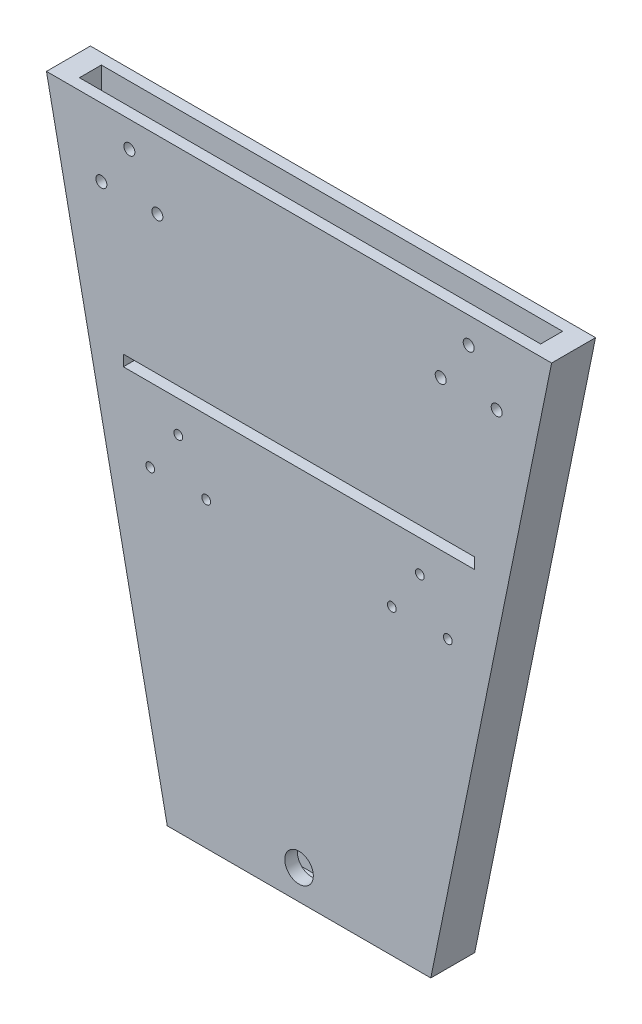
from build123d import *

# Parameters (mm, degrees)
EXTRUDE_1_DEPTH     = 20
SKETCH_3_W          = 210
SKETCH_3_H          = 10
CUT_EXTRUDE_1_DEPTH = 15
SKETCH_4_W          = 160
SKETCH_4_H          = 5
CUT_EXTRUDE_2_DEPTH = 10
SKETCH_5_R          = 2.5
SKETCH_5_R_2        = 2
CUT_EXTRUDE_3_DEPTH = 10
CUT_EXTRUDE_4_DEPTH = 4.25
SKETCH_8_R          = 6.5
CUT_EXTRUDE_6_DEPTH = 15


with BuildPart() as part:
    # 草图1 → 凸台-拉伸1 (new body)
    with BuildSketch(Plane.XY):
        Polygon((-115, 220), (115, 220), (60, -50), (-60, -50), align=None)
    extrude(amount=EXTRUDE_1_DEPTH)

    # 草图3 → 切除-拉伸1 (cut)
    with BuildSketch(Plane(origin=(0, 220, 0), x_dir=(1, 0, 0), z_dir=(0, 1, 0))):
        with Locations((0, -10)):
            Rectangle(SKETCH_3_W, SKETCH_3_H)
    extrude(amount=-CUT_EXTRUDE_1_DEPTH, mode=Mode.SUBTRACT)

    # 草图4 → 切除-拉伸2 (cut)
    with BuildSketch(Plane.XY.offset(20)):
        with Locations((0, 123.51)):
            Rectangle(SKETCH_4_W, SKETCH_4_H)
    extrude(amount=-CUT_EXTRUDE_2_DEPTH, mode=Mode.SUBTRACT)

    # 草图5 → 切除-拉伸3 (cut)
    with BuildSketch(Plane.XY.offset(20)):
        with Locations((-77.25, 208.1425573)):
            Circle(SKETCH_5_R)
        with Locations((-90, 189)):
            Circle(SKETCH_5_R)
        with Locations((-64.5, 189)):
            Circle(SKETCH_5_R)
        with Locations((-55, 106.6525573)):
            Circle(SKETCH_5_R_2)
        with Locations((-67.75, 87.51)):
            Circle(SKETCH_5_R_2)
        with Locations((-42.25, 87.51)):
            Circle(SKETCH_5_R_2)
        with Locations(Location((42.25, 87.51, 0), (0, 0, 180))):
            Circle(SKETCH_5_R_2)
        with Locations(Location((67.75, 87.51, 0), (0, 0, 180))):
            Circle(SKETCH_5_R_2)
        with Locations(Location((55, 106.6525573, 0), (0, 0, 180))):
            Circle(SKETCH_5_R_2)
        with Locations(Location((64.5, 189, 0), (0, 0, 180))):
            Circle(SKETCH_5_R)
        with Locations(Location((90, 189, 0), (0, 0, 180))):
            Circle(SKETCH_5_R)
        with Locations((77.25, 208.1425573)):
            Circle(SKETCH_5_R)
    extrude(amount=-CUT_EXTRUDE_3_DEPTH, mode=Mode.SUBTRACT)

    # 草图6 → 切除-拉伸4 (cut, symmetric)
    with BuildSketch(Plane(origin=(0, 0, 10), x_dir=(-1, 0, 0), z_dir=(0, 0, -1))):
        with BuildLine():
            Line((0, -49.69), (18.016092171, -49.69))
            Line((18.016092171, -49.69), (11.781592332, -23.29))
            Line((11.781592332, -23.29), (0, -23.29))
            ThreePointArc((0, -23.29), (-13.2, -36.49), (0, -49.69))
        make_face()
    extrude(amount=CUT_EXTRUDE_4_DEPTH, both=True, mode=Mode.SUBTRACT)

    # 草图8 → 切除-拉伸6 (cut)
    with BuildSketch(Plane.XY.offset(20)):
        with Locations((0, -36.49)):
            Circle(SKETCH_8_R)
    extrude(amount=-CUT_EXTRUDE_6_DEPTH, mode=Mode.SUBTRACT)


solid = part.part
